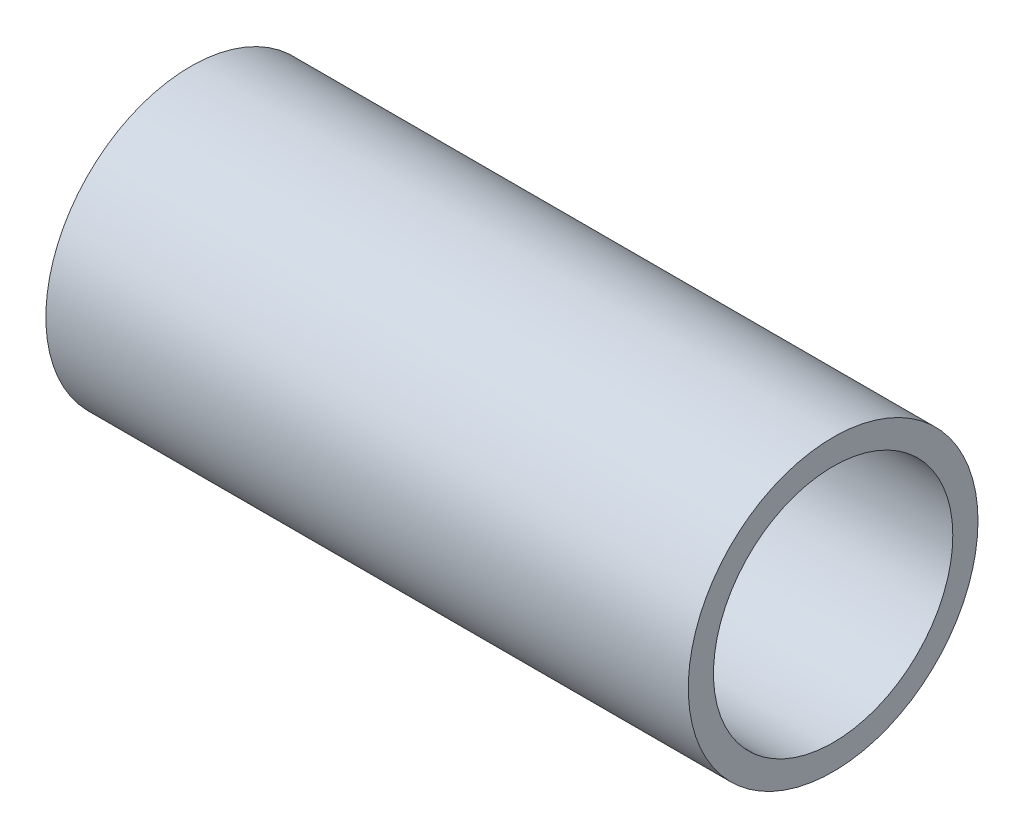
from build123d import *

# Parameters (mm, degrees)
ESQUISSE1_R        = 5.75
ESQUISSE1_R_2      = 4.75
EXTRU_MINCE1_DEPTH = 25.5


with BuildPart() as part:
    # Esquisse1 → Extru.-Mince1 (new body)
    with BuildSketch(Plane(origin=(0, 0, 0), x_dir=(0, 0, -1), z_dir=(1, 0, 0))):
        Circle(ESQUISSE1_R)
        Circle(ESQUISSE1_R_2, mode=Mode.SUBTRACT)
    extrude(amount=EXTRU_MINCE1_DEPTH)


solid = part.part
